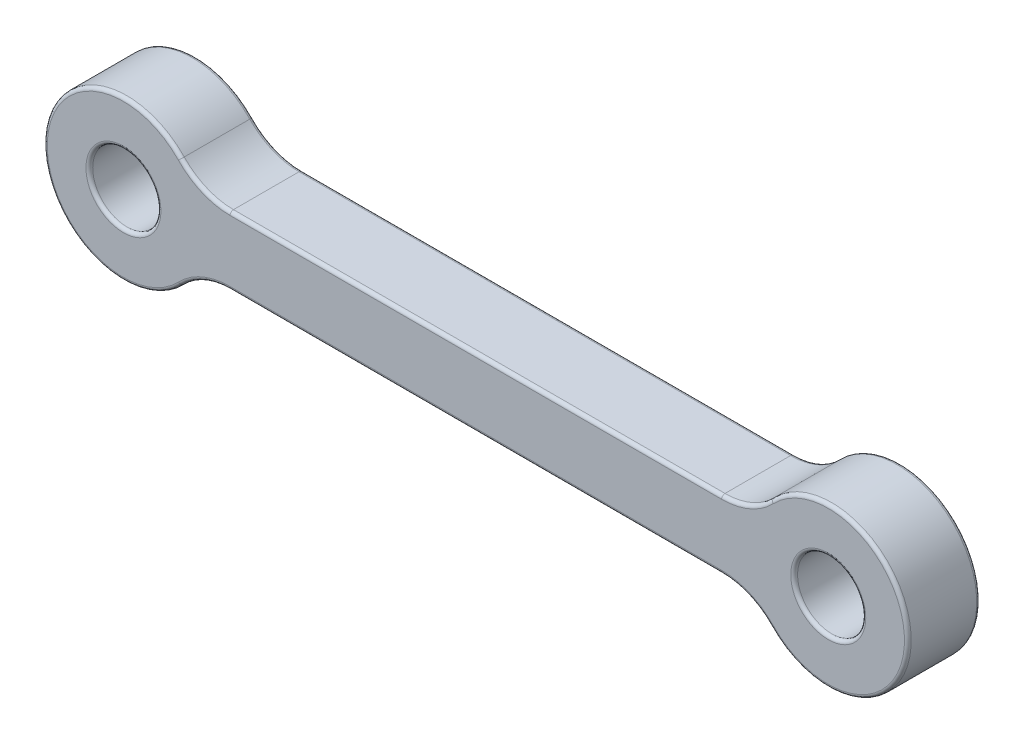
from build123d import *

# Parameters (mm, degrees)
SKETCH1_R           = 3.5
SKETCH1_R_2         = 1.5
BOSS_EXTRUDE1_DEPTH = 3.18
FILLET1_R           = 3
FILLET2_R           = 0.15


with BuildPart() as part:
    # Sketch1 → Boss-Extrude1 (new body)
    # profile 1 of 3: a face of its own
    with BuildSketch(Plane.XY):
        Circle(SKETCH1_R)
        with Locations(Location((0, 0, 0), (0, 0, 180))):
            Circle(SKETCH1_R_2, mode=Mode.SUBTRACT)
    # profile 2 of 3: a face of its own
    with BuildSketch(Plane.XY):
        with BuildLine():
            ThreePointArc((27.83772234, -1.5), (27.5, 0), (27.83772234, 1.5))
            Line((27.83772234, 1.5), (3.16227766, 1.5))
            ThreePointArc((3.16227766, 1.5), (3.414525722, 0.768774411), (3.5, 0))
            ThreePointArc((3.5, 0), (3.414525722, -0.768774411), (3.16227766, -1.5))
            Line((3.16227766, -1.5), (27.83772234, -1.5))
        make_face()
    # profile 3 of 3: a face of its own
    with BuildSketch(Plane.XY):
        with Locations((31, 0)):
            Circle(SKETCH1_R)
        with Locations(Location((31, 0, 0), (0, 0, 180))):
            Circle(SKETCH1_R_2, mode=Mode.SUBTRACT)
    extrude(amount=BOSS_EXTRUDE1_DEPTH)

    # Fillet1
    fillet1_edges = [part.edges().sort_by_distance(p)[0] for p in [
        (27.83772234, 1.5, 1.59),
        (27.83772234, -1.5, 1.59),
        (3.16227766, -1.5, 1.59),
        (3.16227766, 1.5, 1.59),
    ]]
    fillet(fillet1_edges, radius=FILLET1_R)

    # Fillet2
    fillet2_edges = [part.edges().sort_by_distance(p)[0] for p in [
        (15.5, 1.5, 0),
        (15.5, 1.5, 3.18),
        (1.5, 0, 3.18),
        (34.5, 0, 0),
        (34.5, 0, 3.18),
        (-3.5, 0, 0),
        (-3.5, 0, 3.18),
        (32.5, 0, 3.18),
        (15.5, -1.5, 0),
        (15.5, -1.5, 3.18),
        (27.486281051, 1.740401367, 0),
        (27.486281051, 1.740401367, 3.18),
        (3.513718949, 1.740401367, 0),
        (3.513718949, 1.740401367, 3.18),
        (27.486281051, -1.740401367, 0),
        (27.486281051, -1.740401367, 3.18),
        (3.513718949, -1.740401367, 0),
        (3.513718949, -1.740401367, 3.18),
        (32.5, 0, 0),
        (1.5, 0, 0),
    ]]
    fillet(fillet2_edges, radius=FILLET2_R)


solid = part.part
